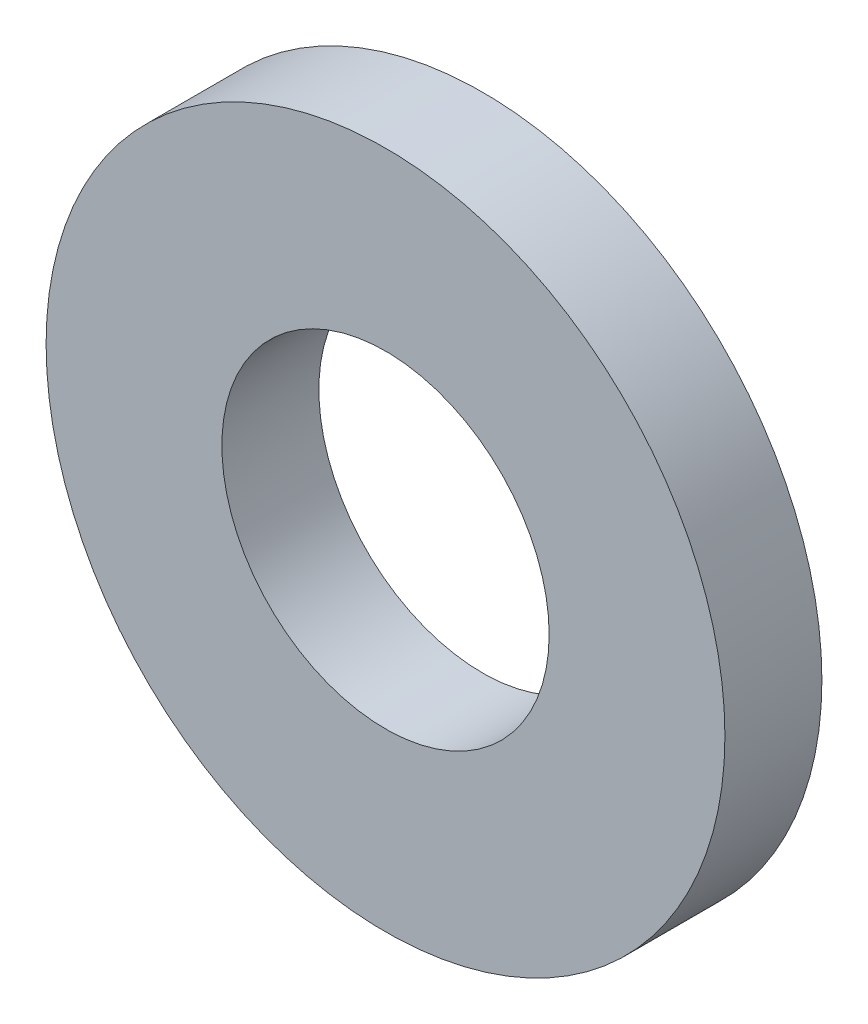
from build123d import *

# Parameters (mm, degrees)
SKETCH3_R           = 2.8
SKETCH3_R_2         = 1.35
BOSS_EXTRUDE1_DEPTH = 0.4


with BuildPart() as part:
    # Sketch3 → Boss-Extrude1 (new, symmetric)
    with BuildSketch(Plane.XY):
        Circle(SKETCH3_R)
        Circle(SKETCH3_R_2, mode=Mode.SUBTRACT)
    extrude(amount=BOSS_EXTRUDE1_DEPTH, both=True)


solid = part.part
